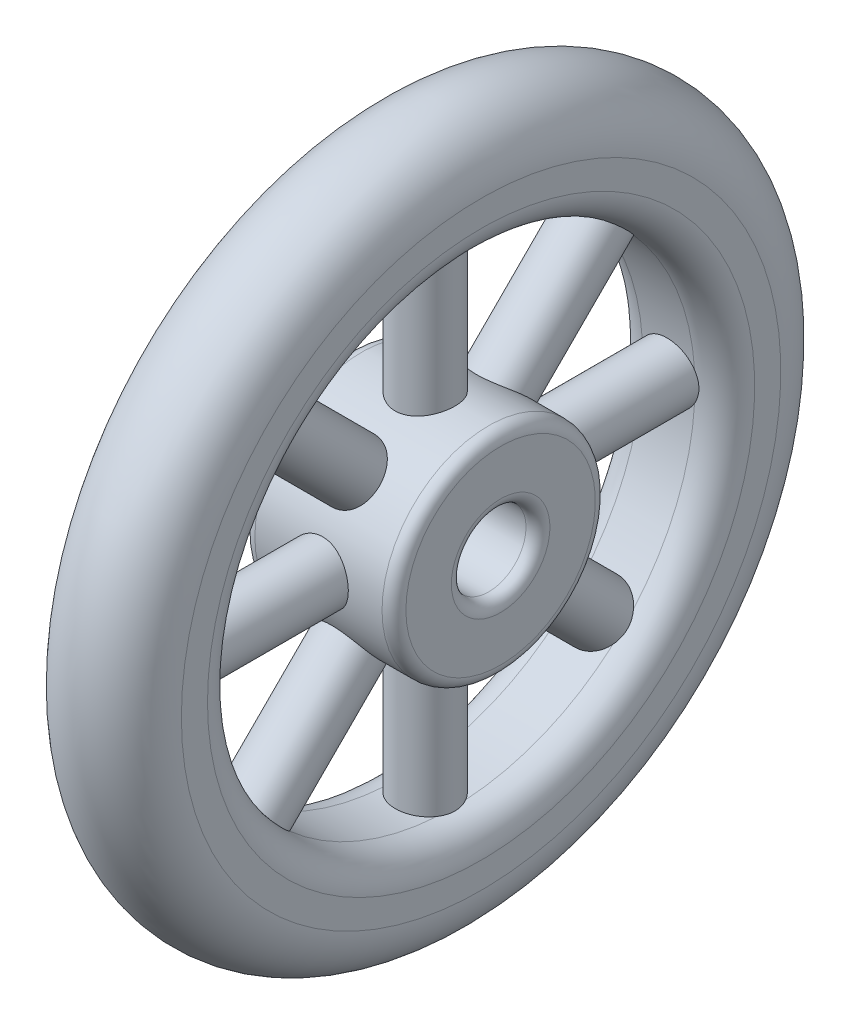
from build123d import *

# Parameters (mm, degrees)
SWEEP1_PROFILE_R  = 1.27
CIRPATTERN1_COUNT = 8


with BuildPart() as part:
    # Sketch3 → Revolve1 (revolve)
    with BuildSketch(Plane.XY, mode=Mode.PRIVATE) as revolve1_sk:
        with BuildLine():
            Line((-2.704226168, 1.5875), (2.704226168, 1.5875))
            ThreePointArc((2.704226168, 1.5875), (3.063436413, 1.736289755), (3.212226168, 2.0955))
            Line((3.212226168, 2.0955), (3.212226168, 4.030158252))
            ThreePointArc((3.212226168, 4.030158252), (3.063436413, 4.389368497), (2.704226168, 4.538158252))
            Line((2.704226168, 4.538158252), (-2.704226168, 4.538158252))
            ThreePointArc((-2.704226168, 4.538158252), (-3.063436413, 4.389368497), (-3.212226168, 4.030158252))
            Line((-3.212226168, 4.030158252), (-3.212226168, 2.0955))
            ThreePointArc((-3.212226168, 2.0955), (-3.063436413, 1.736289755), (-2.704226168, 1.5875))
        make_face()
        with BuildLine():
            Line((-2.38125, 12.751839853), (-2.38125, 11.640589853))
            ThreePointArc((-2.38125, 11.640589853), (-2.009275612, 10.742564241), (-1.11125, 10.370589853))
            Line((-1.11125, 10.370589853), (1.11125, 10.370589853))
            ThreePointArc((1.11125, 10.370589853), (2.009275612, 10.742564241), (2.38125, 11.640589853))
            Line((2.38125, 11.640589853), (2.38125, 12.751839853))
            ThreePointArc((2.38125, 12.751839853), (0, 15.133089853), (-2.38125, 12.751839853))
        make_face()
    revolve(revolve1_sk.sketch.rotate(Axis((-11.977214198, 0, 0), (1, 0, 0)), 90), axis=Axis((-11.977214198, 0, 0), (1, 0, 0)))

    # Sweep1: sweep along a path in Sketch5
    with BuildLine(Plane(origin=(0, 0, 0), x_dir=(0, 0, -1), z_dir=(1, 0, 0))) as sweep1_path:
        Line((0, 3.062829126), (0, 12.751839853))
    # Sweep1 profile (on start of the path) → Sweep1 (sweep)
    with BuildSketch(Plane.ZX.offset(3.062829126)):
        Circle(SWEEP1_PROFILE_R)
    sweep1 = sweep(path=sweep1_path.line)

    # CirPattern1: Sweep1 ×8 about axis
    cirpattern1_axis = Axis((-11.977214198, 0, 0), (1, 0, 0))
    for i in range(1, CIRPATTERN1_COUNT):
        add(sweep1.rotate(cirpattern1_axis, i * 360 / CIRPATTERN1_COUNT))


solid = part.part
